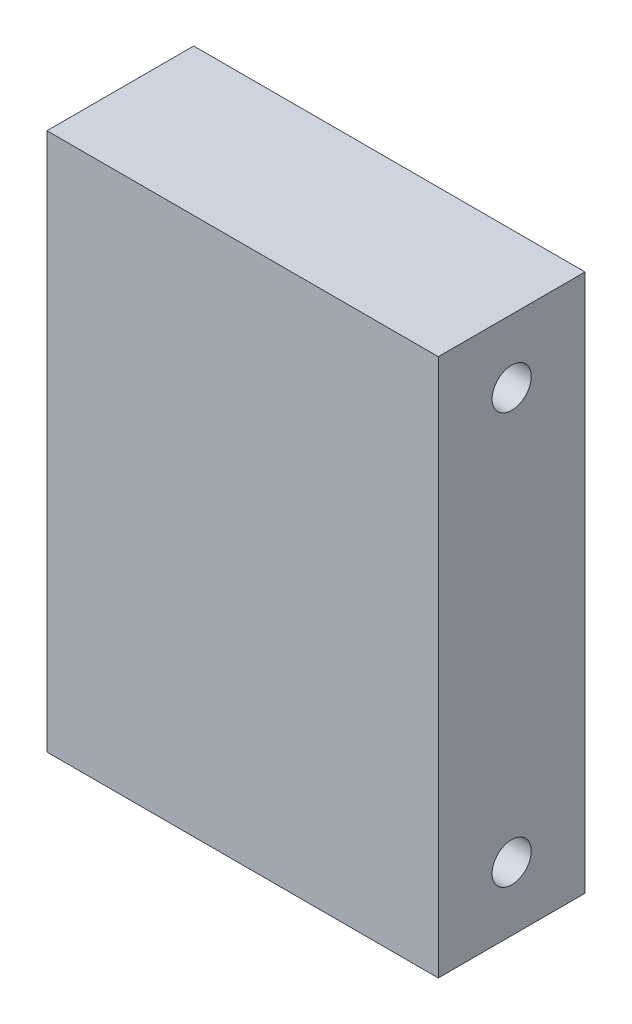
from build123d import *

# Parameters (mm, degrees)
ESQUISSE1_W             = 40
ESQUISSE1_H             = 55
BOSS_EXTRU_1_DEPTH      = 15
ESQUISSE2_R             = 2
ENL_V_MAT_EXTRU_1_DEPTH = 5
ENL_V_START             = -5
ESQUISSE3_R             = 2
ENL_V_MAT_EXTRU_2_DEPTH = 5


with BuildPart() as part:
    # Esquisse1 → Boss.-Extru.1 (new body)
    with BuildSketch(Plane.XY):
        Rectangle(ESQUISSE1_W, ESQUISSE1_H)
    extrude(amount=BOSS_EXTRU_1_DEPTH)

    # Esquisse2 → Enlèv. mat.-Extru.1 (cut)
    with BuildSketch(Plane(origin=(20, 0, 0), x_dir=(0, 0, -1), z_dir=(1, 0, 0))):
        with Locations(Location((-7.5, 21, 0), (0, 0, 90))):
            Circle(ESQUISSE2_R)
        with Locations(Location((-7.5, -21, 0), (0, 0, 90))):
            Circle(ESQUISSE2_R)
    extrude(amount=-ENL_V_MAT_EXTRU_1_DEPTH, mode=Mode.SUBTRACT)

    # Esquisse3 → Enlèv. mat.-Extru.2 (cut)
    with BuildSketch(Plane.ZY.offset(20).offset(ENL_V_START)):
        with Locations(Location((7.5, 21, 0), (0, 0, 90))):
            Circle(ESQUISSE3_R)
        with Locations(Location((7.5, -21, 0), (0, 0, 90))):
            Circle(ESQUISSE3_R)
    extrude(amount=ENL_V_MAT_EXTRU_2_DEPTH, mode=Mode.SUBTRACT)


solid = part.part
